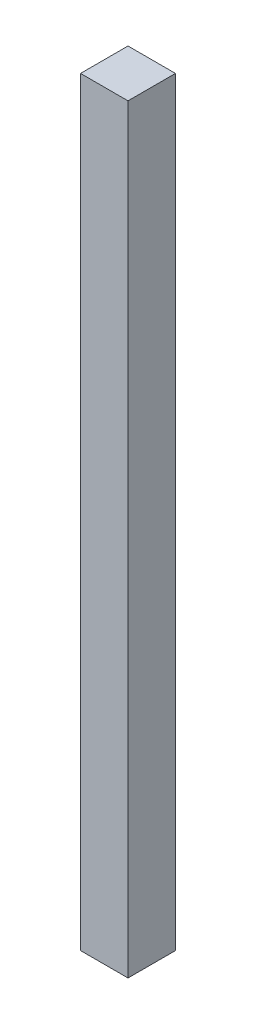
from build123d import *

# Parameters (mm, degrees)
SKETCH1_W           = 12.7
SKETCH1_H           = 12.7
BOSS_EXTRUDE1_DEPTH = 203.2


with BuildPart() as part:
    # Sketch1 → Boss-Extrude1 (new body)
    with BuildSketch(Plane(origin=(0, 0, 0), x_dir=(1, 0, 0), z_dir=(0, 1, 0))):
        with Locations((6.35, 6.35)):
            Rectangle(SKETCH1_W, SKETCH1_H)
    extrude(amount=BOSS_EXTRUDE1_DEPTH)


solid = part.part
